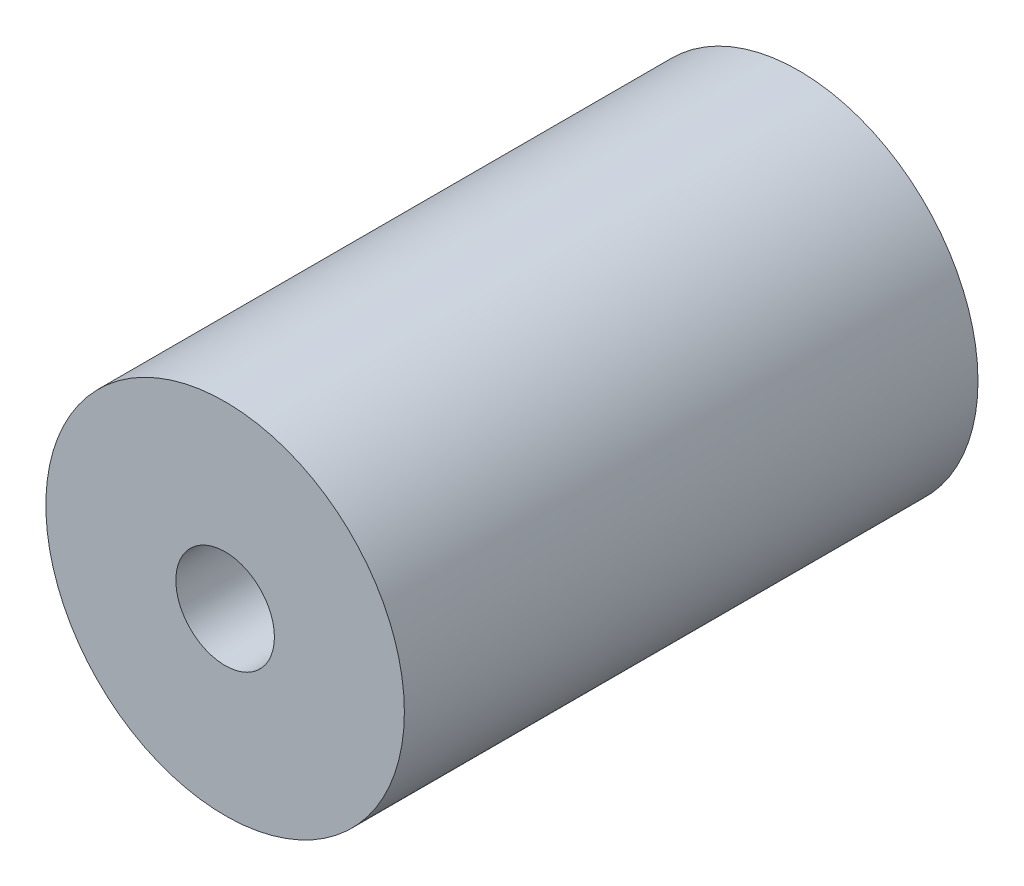
from build123d import *

# Parameters (mm, degrees)
SKIZZE1_R                       = 10
SKIZZE1_R_2                     = 2.75
AUFSATZ_LINEAR_AUSTRAGEN1_DEPTH = 32


with BuildPart() as part:
    # Skizze1 → Aufsatz-Linear austragen1 (new body)
    with BuildSketch(Plane.XY):
        Circle(SKIZZE1_R)
        Circle(SKIZZE1_R_2, mode=Mode.SUBTRACT)
    extrude(amount=AUFSATZ_LINEAR_AUSTRAGEN1_DEPTH)


solid = part.part
